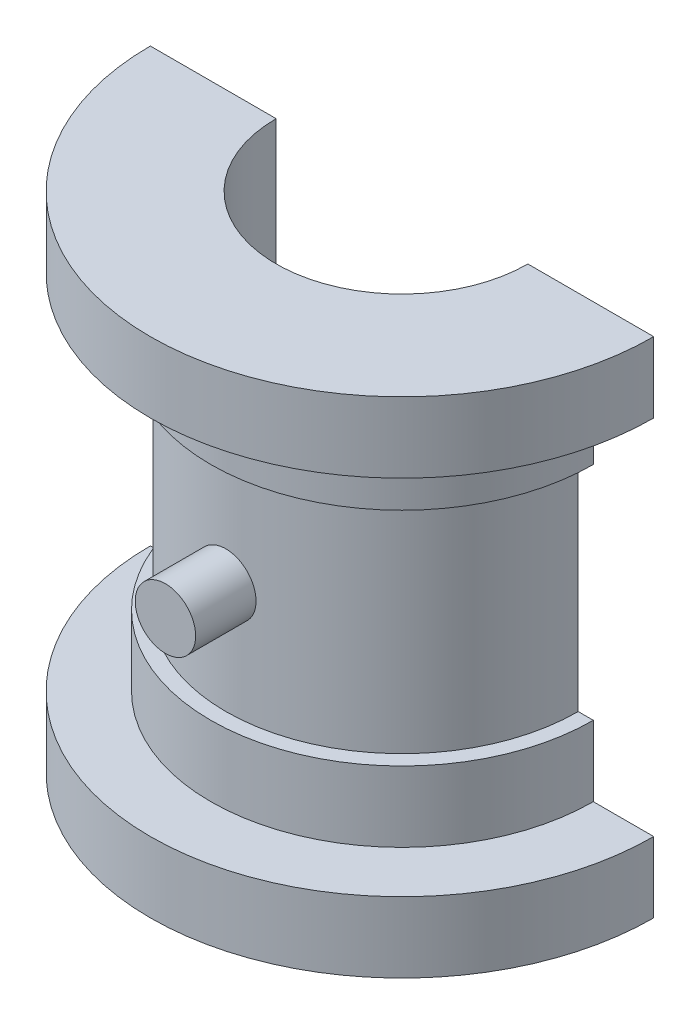
from build123d import *

# Parameters (mm, degrees)
CUT_EXTRUDE2_DEPTH      = 62.23724357
CUT_EXTRUDE2_DEPTH_BACK = 62.23724357
SKETCH4_R               = 3
BOSS_EXTRUDE1_DEPTH     = 6


with BuildPart() as part:
    # Sketch1 → Revolve1 (revolve)
    with BuildSketch(Plane.XY, mode=Mode.PRIVATE) as revolve1_sk:
        Polygon((12.5, 25), (12.5, -25), (25, -25), (25, -18), (19, -18), (19, -11), (17.5, -11), (17.5, 11), (19, 11), (19, 18), (25, 18), (25, 25), align=None)
    revolve(revolve1_sk.sketch.rotate(Axis((0, 26.261829653, 0), (0, -1, 0)), 90), axis=Axis((0, 26.261829653, 0), (0, -1, 0)))

    # Sketch2 → Cut-Extrude2 (cut, two sides: drawn at the far end of the back side and taken through both)
    with BuildSketch(Plane(origin=(0, 25, 0), x_dir=(1, 0, 0), z_dir=(0, 1, 0)).offset(-CUT_EXTRUDE2_DEPTH_BACK)):
        Polygon((-146.803398875, 0), (-25, 0), (25, 0), (146.803398875, 0), (146.803398875, 243.60679775), (-146.803398875, 243.60679775), align=None)
    extrude(amount=CUT_EXTRUDE2_DEPTH + CUT_EXTRUDE2_DEPTH_BACK, mode=Mode.SUBTRACT)


with BuildPart() as body_2:
    # Sketch4 → Boss-Extrude1 (new body)
    with BuildSketch(Plane.XY.offset(17.5)):
        Circle(SKETCH4_R)
    extrude(amount=BOSS_EXTRUDE1_DEPTH)


solid = Compound([part.part, body_2.part])
